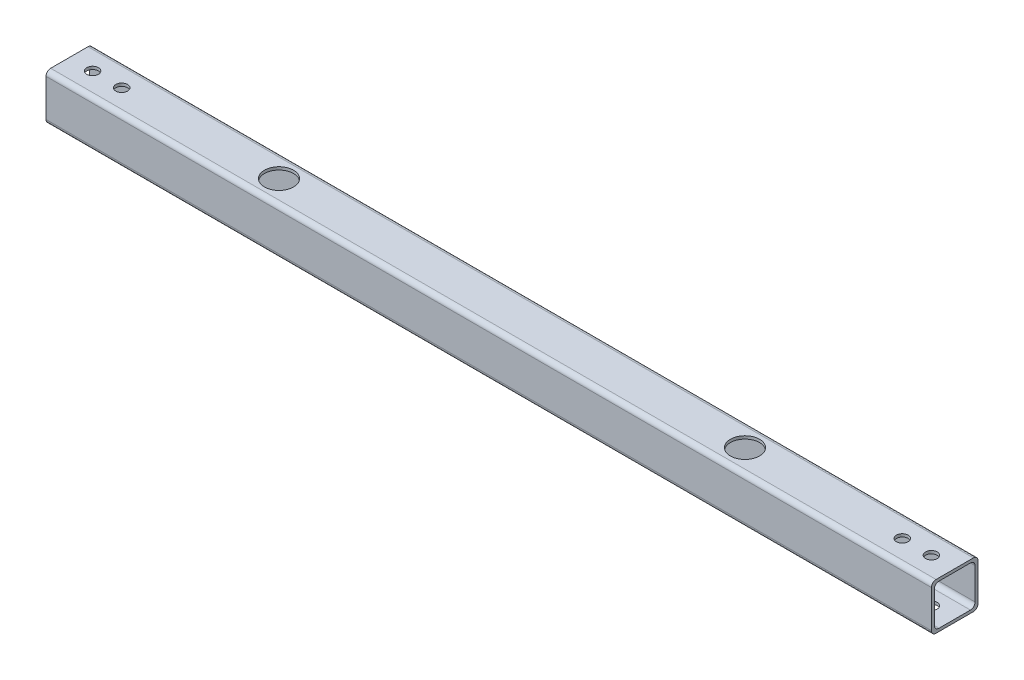
from build123d import *

# Parameters (mm, degrees)
SKETCH1_W           = 25.4
SKETCH1_H           = 25.4
SKETCH1_W_2         = 22.225
SKETCH1_H_2         = 22.225
BOSS_EXTRUDE1_DEPTH = 241.3
FILLET1_R           = 2.54
CUT_EXTRUDE1_REACH  = 244.965
SKETCH2_R           = 3.175
CUT_EXTRUDE2_REACH  = 244.965
SKETCH3_R           = 7.9375
CUT_EXTRUDE3_REACH  = 244.965
SKETCH4_R           = 3.175


with BuildPart() as part:
    # Sketch1 → Boss-Extrude1 (new, symmetric)
    with BuildSketch(Plane(origin=(0, 0, 0), x_dir=(0, 0, -1), z_dir=(1, 0, 0))):
        Rectangle(SKETCH1_W, SKETCH1_H)
        Rectangle(SKETCH1_W_2, SKETCH1_H_2, mode=Mode.SUBTRACT)
    extrude(amount=BOSS_EXTRUDE1_DEPTH, both=True)

    # Fillet1
    fillet1_edges = [part.edges().sort_by_distance(p)[0] for p in [
        (0, -11.1125, -11.1125),
        (0, 11.1125, -11.1125),
        (0, 11.1125, 11.1125),
        (0, -11.1125, 11.1125),
        (0, -12.7, -12.7),
        (0, -12.7, 12.7),
        (0, 12.7, 12.7),
        (0, 12.7, -12.7),
    ]]
    fillet(fillet1_edges, radius=FILLET1_R)

    # Sketch2 → Cut-Extrude1 (cut, up to next)
    with BuildSketch(Plane(origin=(0, -12.7, 0), x_dir=(1, 0, 0), z_dir=(0, 1, 0)), mode=Mode.PRIVATE) as cut_extrude1_sk1:
        with Locations(Location((127, 0, 0), (0, 0, 90))):
            Circle(SKETCH2_R)
    cut_extrude1_tool1 = extrude(cut_extrude1_sk1.sketch, amount=CUT_EXTRUDE1_REACH, mode=Mode.PRIVATE) & part.part
    # Sketch2 → Cut-Extrude1 (cut, up to next)
    with BuildSketch(Plane(origin=(0, -12.7, 0), x_dir=(1, 0, 0), z_dir=(0, 1, 0)), mode=Mode.PRIVATE) as cut_extrude1_sk2:
        with Locations(Location((-127, 0, 0), (0, 0, 90))):
            Circle(SKETCH2_R)
    cut_extrude1_tool2 = extrude(cut_extrude1_sk2.sketch, amount=CUT_EXTRUDE1_REACH, mode=Mode.PRIVATE) & part.part
    add(cut_extrude1_tool1.solids().sort_by_distance((127, -12.7, 0))[0], mode=Mode.SUBTRACT)
    add(cut_extrude1_tool2.solids().sort_by_distance((-127, -12.7, 0))[0], mode=Mode.SUBTRACT)

    # Sketch3 → Cut-Extrude2 (cut, up to next)
    with BuildSketch(Plane(origin=(0, 12.7, 0), x_dir=(1, 0, 0), z_dir=(0, 1, 0)), mode=Mode.PRIVATE) as cut_extrude2_sk1:
        with Locations(Location((-127, 0, 0), (0, 0, 270))):
            Circle(SKETCH3_R)
    cut_extrude2_tool1 = extrude(cut_extrude2_sk1.sketch, amount=-CUT_EXTRUDE2_REACH, mode=Mode.PRIVATE) & part.part
    # Sketch3 → Cut-Extrude2 (cut, up to next)
    with BuildSketch(Plane(origin=(0, 12.7, 0), x_dir=(1, 0, 0), z_dir=(0, 1, 0)), mode=Mode.PRIVATE) as cut_extrude2_sk2:
        with Locations(Location((127, 0, 0), (0, 0, 270))):
            Circle(SKETCH3_R)
    cut_extrude2_tool2 = extrude(cut_extrude2_sk2.sketch, amount=-CUT_EXTRUDE2_REACH, mode=Mode.PRIVATE) & part.part
    add(cut_extrude2_tool1.solids().sort_by_distance((-127, 12.7, 0))[0], mode=Mode.SUBTRACT)
    add(cut_extrude2_tool2.solids().sort_by_distance((127, 12.7, 0))[0], mode=Mode.SUBTRACT)

    # Cut-Extrude3: up to this face of the body (flat: up to its plane)
    cut_extrude3_end = Plane(part.part.faces().sort_by_distance((0, -12.7, 0))[0])
    # Sketch4 → Cut-Extrude3 (cut, up to the picked face)
    with BuildSketch(Plane(origin=(0, 12.7, 0), x_dir=(1, 0, 0), z_dir=(0, 1, 0)), mode=Mode.PRIVATE) as cut_extrude3_sk1:
        with Locations(Location((-228.6, 0, 0), (0, 0, 270))):
            Circle(SKETCH4_R)
    cut_extrude3_tool1 = split(extrude(cut_extrude3_sk1.sketch, amount=-CUT_EXTRUDE3_REACH, mode=Mode.PRIVATE), bisect_by=cut_extrude3_end, keep=Keep.BOTH, mode=Mode.PRIVATE)
    # Sketch4 → Cut-Extrude3 (cut, up to the picked face)
    with BuildSketch(Plane(origin=(0, 12.7, 0), x_dir=(1, 0, 0), z_dir=(0, 1, 0)), mode=Mode.PRIVATE) as cut_extrude3_sk2:
        with Locations(Location((-212.725, 0, 0), (0, 0, 270))):
            Circle(SKETCH4_R)
    cut_extrude3_tool2 = split(extrude(cut_extrude3_sk2.sketch, amount=-CUT_EXTRUDE3_REACH, mode=Mode.PRIVATE), bisect_by=cut_extrude3_end, keep=Keep.BOTH, mode=Mode.PRIVATE)
    cut_extrude3_1 = cut_extrude3_tool1.solids().sort_by(Axis((-228.6, 12.7, 0), (0, -1, 0)))[0]
    add(cut_extrude3_1, mode=Mode.SUBTRACT)
    cut_extrude3_2 = cut_extrude3_tool2.solids().sort_by(Axis((-212.725, 12.7, 0), (0, -1, 0)))[0]
    add(cut_extrude3_2, mode=Mode.SUBTRACT)
    cut_extrude3 = cut_extrude3_1 + cut_extrude3_2  # Cut-Extrude3 as one shape, for the pattern or mirror that repeats it

    # Mirror1: Cut-Extrude3 across plane
    add(cut_extrude3.mirror(Plane(origin=(0, 0, 0), x_dir=(0, 0, 1), z_dir=(1, 0, 0))), mode=Mode.SUBTRACT)


solid = part.part
